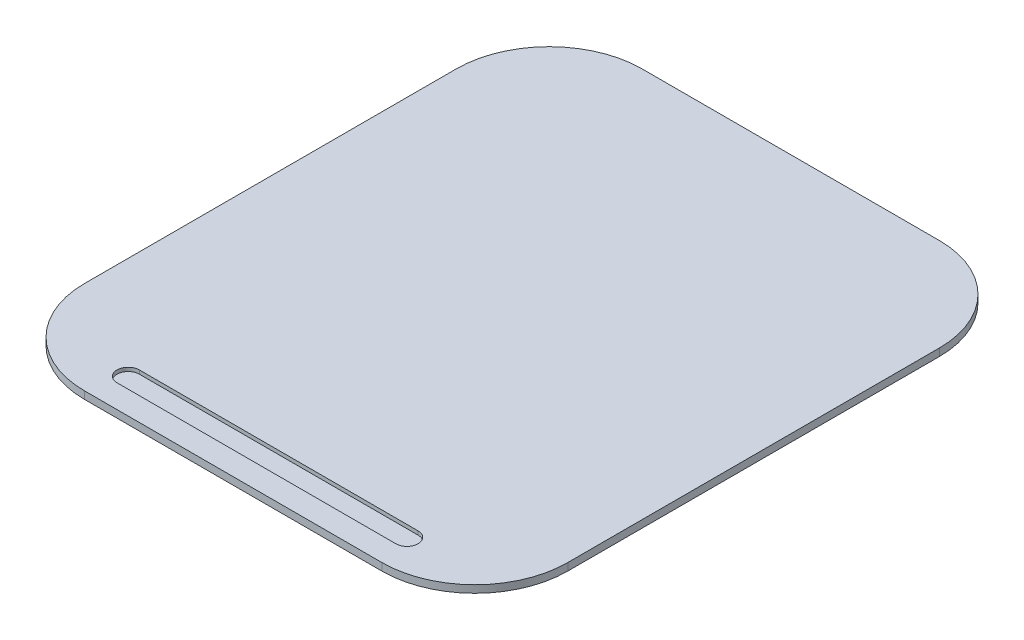
from build123d import *

# Parameters (mm, degrees)
CHAPAINFERIOR_DEPTH   = 4
CORTE_EXTRUS_O1_DEPTH = 398.008816023


with BuildPart() as part:
    # Chapa inferior → ChapaInferior (new, symmetric)
    with BuildSketch(Plane(origin=(0, 0, 0), x_dir=(1, 0, 0), z_dir=(0, 1, 0))):
        with BuildLine():
            Line((-160, 300), (160, 300))
            ThreePointArc((160, 300), (230.710678119, 270.710678119), (260, 200))
            Line((260, 200), (260, -200))
            ThreePointArc((260, -200), (230.710678119, -270.710678119), (160, -300))
            Line((160, -300), (-160, -300))
            ThreePointArc((-160, -300), (-230.710678119, -270.710678119), (-260, -200))
            Line((-260, -200), (-260, 200))
            ThreePointArc((-260, 200), (-230.710678119, 270.710678119), (-160, 300))
        make_face()
    extrude(amount=CHAPAINFERIOR_DEPTH, both=True)

    # Esboço2 → Corte-extrusão1 (cut, through all)
    with BuildSketch(Plane(origin=(0, 0, 0), x_dir=(1, 0, 0), z_dir=(0, 1, 0))):
        with BuildLine():
            Line((-150, -251), (150, -251))
            ThreePointArc((150, -251), (162, -263), (150, -275))
            Line((150, -275), (-150, -275))
            ThreePointArc((-150, -275), (-162, -263), (-150, -251))
        make_face()
    extrude(amount=CORTE_EXTRUS_O1_DEPTH, mode=Mode.SUBTRACT)


solid = part.part
